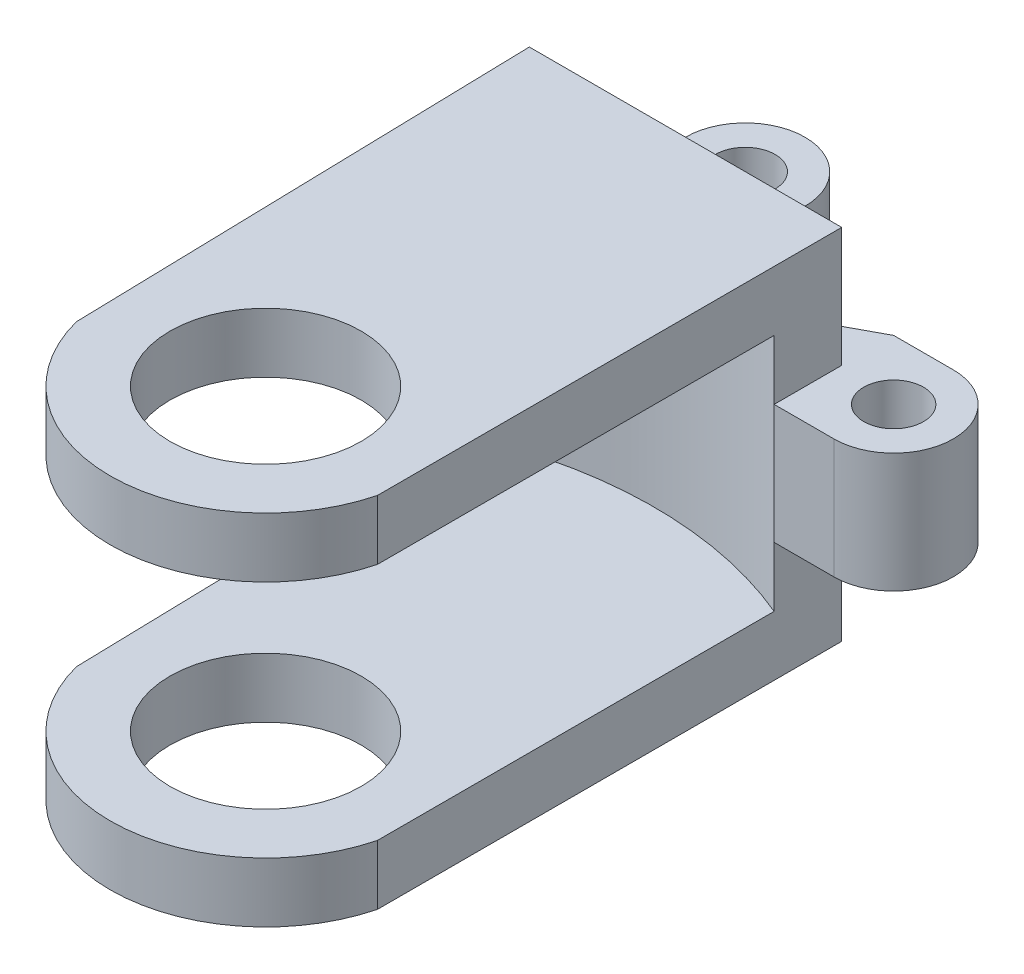
from build123d import *

# Parameters (mm, degrees)
SKETCH1_R           = 16.51
SKETCH1_R_2         = 10.16
BOSS_EXTRUDE1_DEPTH = 38.1
CUT_EXTRUDE1_START  = 6.35
SKETCH1_3_R         = 16.51
SKETCH1_3_R_2       = 10.16
CUT_EXTRUDE1_DEPTH  = 25.4
CUT_EXTRUDE2_REACH  = 66.365
BOSS_EXTRUDE2_START = 6.35
SKETCH7_R           = 3.175
BOSS_EXTRUDE2_DEPTH = 6.35
BOSS_EXTRUDE3_DEPTH = 6.35


with BuildPart() as part:
    # Sketch1 → Boss-Extrude1 (new body)
    # profile 1 of 4: a face of its own
    with BuildSketch(Plane(origin=(0, 0, 0), x_dir=(1, 0, 0), z_dir=(0, 1, 0))):
        with BuildLine():
            Line((-25.4, 45.234068682), (-25.4, 32.534068682))
            ThreePointArc((-25.4, 32.534068682), (0, 41.275), (25.4, 32.534068682))
            Line((25.4, 32.534068682), (25.4, 45.234068682))
            Line((25.4, 45.234068682), (-25.4, 45.234068682))
        make_face()
    # profile 2 of 4: a face of its own
    with BuildSketch(Plane(origin=(0, 0, 0), x_dir=(1, 0, 0), z_dir=(0, 1, 0))):
        with BuildLine():
            ThreePointArc((25.4, 32.534068682), (0, 41.275), (-25.4, 32.534068682))
            Line((-25.4, 32.534068682), (25.4, 32.534068682))
        make_face()
    # profile 3 of 4: a face of its own
    with BuildSketch(Plane(origin=(0, 0, 0), x_dir=(1, 0, 0), z_dir=(0, 1, 0))):
        with BuildLine():
            Line((25.4, 32.534068682), (-25.4, 32.534068682))
            Line((-25.4, 32.534068682), (-15.991186592, -4.106342823))
            ThreePointArc((-15.991186592, -4.106342823), (-2.069493823, 16.379783128), (16.51, 0))
            ThreePointArc((16.51, 0), (16.379783128, -2.069493823), (15.991186592, -4.106342823))
            Line((15.991186592, -4.106342823), (25.4, 32.534068682))
        make_face()
    # profile 4 of 4: a face of its own
    with BuildSketch(Plane(origin=(0, 0, 0), x_dir=(1, 0, 0), z_dir=(0, 1, 0))):
        Circle(SKETCH1_R)
        with Locations(Location((0, 0, 0), (0, 0, 90))):
            Circle(SKETCH1_R_2, mode=Mode.SUBTRACT)
    extrude(amount=BOSS_EXTRUDE1_DEPTH)

    # Sketch1<3> → Cut-Extrude1 (cut)
    # profile 1 of 3: a face of its own
    with BuildSketch(Plane(origin=(0, 0, 0), x_dir=(1, 0, 0), z_dir=(0, 1, 0)).offset(CUT_EXTRUDE1_START)):
        with BuildLine():
            Line((25.4, 32.534068682), (-25.4, 32.534068682))
            Line((-25.4, 32.534068682), (-15.991186592, -4.106342823))
            ThreePointArc((-15.991186592, -4.106342823), (-2.069493823, 16.379783128), (16.51, 0))
            ThreePointArc((16.51, 0), (16.379783128, -2.069493823), (15.991186592, -4.106342823))
            Line((15.991186592, -4.106342823), (25.4, 32.534068682))
        make_face()
    # profile 2 of 3: a face of its own
    with BuildSketch(Plane(origin=(0, 0, 0), x_dir=(1, 0, 0), z_dir=(0, 1, 0)).offset(CUT_EXTRUDE1_START)):
        with BuildLine():
            ThreePointArc((25.4, 32.534068682), (0, 41.275), (-25.4, 32.534068682))
            Line((-25.4, 32.534068682), (25.4, 32.534068682))
        make_face()
    # profile 3 of 3: a face of its own
    with BuildSketch(Plane(origin=(0, 0, 0), x_dir=(1, 0, 0), z_dir=(0, 1, 0)).offset(CUT_EXTRUDE1_START)):
        Circle(SKETCH1_3_R)
        with Locations(Location((0, 0, 0), (0, 0, 90))):
            Circle(SKETCH1_3_R_2, mode=Mode.SUBTRACT)
    extrude(amount=CUT_EXTRUDE1_DEPTH, mode=Mode.SUBTRACT)

    # Cut-Extrude2: up to this face of the body (flat: up to its plane)
    cut_extrude2_end = Plane(part.part.faces().sort_by_distance((0, 0, -21.591993841))[0])
    # Sketch5 → Cut-Extrude2 (cut, up to the picked face)
    with BuildSketch(Plane(origin=(0, 38.1, 0), x_dir=(1, 0, 0), z_dir=(0, 1, 0)), mode=Mode.PRIVATE) as cut_extrude2_sk1:
        Polygon((15.991186592, 45.234068682), (15.991186592, -4.106342823), (25.4, 32.534068682), (25.4, 45.234068682), align=None)
    cut_extrude2_tool1 = split(extrude(cut_extrude2_sk1.sketch, amount=-CUT_EXTRUDE2_REACH, mode=Mode.PRIVATE), bisect_by=cut_extrude2_end, keep=Keep.BOTH, mode=Mode.PRIVATE)
    # Sketch5 → Cut-Extrude2 (cut, up to the picked face)
    with BuildSketch(Plane(origin=(0, 38.1, 0), x_dir=(1, 0, 0), z_dir=(0, 1, 0)), mode=Mode.PRIVATE) as cut_extrude2_sk2:
        Polygon((-25.4, 32.534068682), (-15.991186592, -4.106342823), (-17.209379635, 45.234068682), (-25.4, 45.234068682), align=None)
    cut_extrude2_tool2 = split(extrude(cut_extrude2_sk2.sketch, amount=-CUT_EXTRUDE2_REACH, mode=Mode.PRIVATE), bisect_by=cut_extrude2_end, keep=Keep.BOTH, mode=Mode.PRIVATE)
    add(cut_extrude2_tool1.solids().sort_by(Axis((19.769469, 38.1, -27.920679), (0, -1, 0)))[0], mode=Mode.SUBTRACT)
    add(cut_extrude2_tool2.solids().sort_by(Axis((-20.156564, 38.1, -27.821204), (0, -1, 0)))[0], mode=Mode.SUBTRACT)

    # Sketch7 → Boss-Extrude2 (add)
    with BuildSketch(Plane(origin=(0, 19.05, 0), x_dir=(1, 0, 0), z_dir=(0, 1, 0)).offset(BOSS_EXTRUDE2_START)):
        with BuildLine():
            Line((5.740903479, 45.234068682), (5.740903479, 51.584068682))
            ThreePointArc((5.740903479, 51.584068682), (-0.609096521, 57.934068682), (-6.959096521, 51.584068682))
            Line((-6.959096521, 51.584068682), (-6.959096521, 45.234068682))
            Line((-6.959096521, 45.234068682), (-0.609096521, 45.234068682))
            Line((-0.609096521, 45.234068682), (5.740903479, 45.234068682))
        make_face()
        with Locations(Location((-0.609096521, 51.584068682, 0), (0, 0, 270))):
            Circle(SKETCH7_R, mode=Mode.SUBTRACT)
    boss_extrude2 = extrude(amount=BOSS_EXTRUDE2_DEPTH)

    # Sketch8 → Boss-Extrude3 (add)
    with BuildSketch(Plane(origin=(0, 19.05, 0), x_dir=(1, 0, 0), z_dir=(0, 1, 0))):
        with BuildLine():
            ThreePointArc((15.991186592, 44.401380742), (17.851058531, 39.911252682), (22.341186592, 38.051380742))
            Line((22.341186592, 38.051380742), (22.341186592, 41.226380742))
            ThreePointArc((22.341186592, 41.226380742), (19.166186592, 44.401380742), (22.341186592, 47.576380742))
            Line((22.341186592, 47.576380742), (22.341186592, 50.751380742))
            ThreePointArc((22.341186592, 50.751380742), (17.851058531, 48.891508803), (15.991186592, 44.401380742))
        make_face()
        with BuildLine():
            Line((22.341186592, 41.226380742), (22.341186592, 38.051380742))
            ThreePointArc((22.341186592, 38.051380742), (26.831314653, 39.911252682), (28.691186592, 44.401380742))
            ThreePointArc((28.691186592, 44.401380742), (26.831314653, 48.891508803), (22.341186592, 50.751380742))
            Line((22.341186592, 50.751380742), (22.341186592, 47.576380742))
            ThreePointArc((22.341186592, 47.576380742), (24.586250622, 46.646444772), (25.516186592, 44.401380742))
            ThreePointArc((25.516186592, 44.401380742), (24.586250622, 42.156316712), (22.341186592, 41.226380742))
        make_face()
        with BuildLine():
            ThreePointArc((15.991186592, 44.401380742), (17.851058531, 39.911252682), (22.341186592, 38.051380742))
            Line((22.341186592, 38.051380742), (22.341186592, 41.226380742))
            ThreePointArc((22.341186592, 41.226380742), (19.166186592, 44.401380742), (22.341186592, 47.576380742))
            Line((22.341186592, 47.576380742), (22.341186592, 50.751380742))
            ThreePointArc((22.341186592, 50.751380742), (17.851058531, 48.891508803), (15.991186592, 44.401380742))
        make_face()
        with BuildLine():
            Line((22.341186592, 41.226380742), (22.341186592, 38.051380742))
            ThreePointArc((22.341186592, 38.051380742), (26.831314653, 39.911252682), (28.691186592, 44.401380742))
            ThreePointArc((28.691186592, 44.401380742), (26.831314653, 48.891508803), (22.341186592, 50.751380742))
            Line((22.341186592, 50.751380742), (22.341186592, 47.576380742))
            ThreePointArc((22.341186592, 47.576380742), (24.586250622, 46.646444772), (25.516186592, 44.401380742))
            ThreePointArc((25.516186592, 44.401380742), (24.586250622, 42.156316712), (22.341186592, 41.226380742))
        make_face()
        with BuildLine():
            Line((15.991186592, 45.234068682), (15.991186592, 44.401380742))
            ThreePointArc((15.991186592, 44.401380742), (17.851058531, 48.891508803), (22.341186592, 50.751380742))
            Line((22.341186592, 50.751380742), (15.991186592, 50.751380742))
            Line((15.991186592, 50.751380742), (15.991186592, 45.234068682))
        make_face()
        with BuildLine():
            Line((15.991186592, 44.401380742), (15.991186592, 38.051380742))
            Line((15.991186592, 38.051380742), (22.341186592, 38.051380742))
            ThreePointArc((22.341186592, 38.051380742), (17.851058531, 39.911252682), (15.991186592, 44.401380742))
        make_face()
        Polygon((15.991186592, 50.751380742), (15.991186592, 45.234068682), (5.740903479, 45.234068682), align=None)
    boss_extrude3 = extrude(amount=BOSS_EXTRUDE3_DEPTH)

    # Mirror1: Boss-Extrude2, Boss-Extrude3 across plane
    add(boss_extrude2.mirror(Plane.ZX.offset(19.05)))
    add(boss_extrude3.mirror(Plane.ZX.offset(19.05)))


solid = part.part
